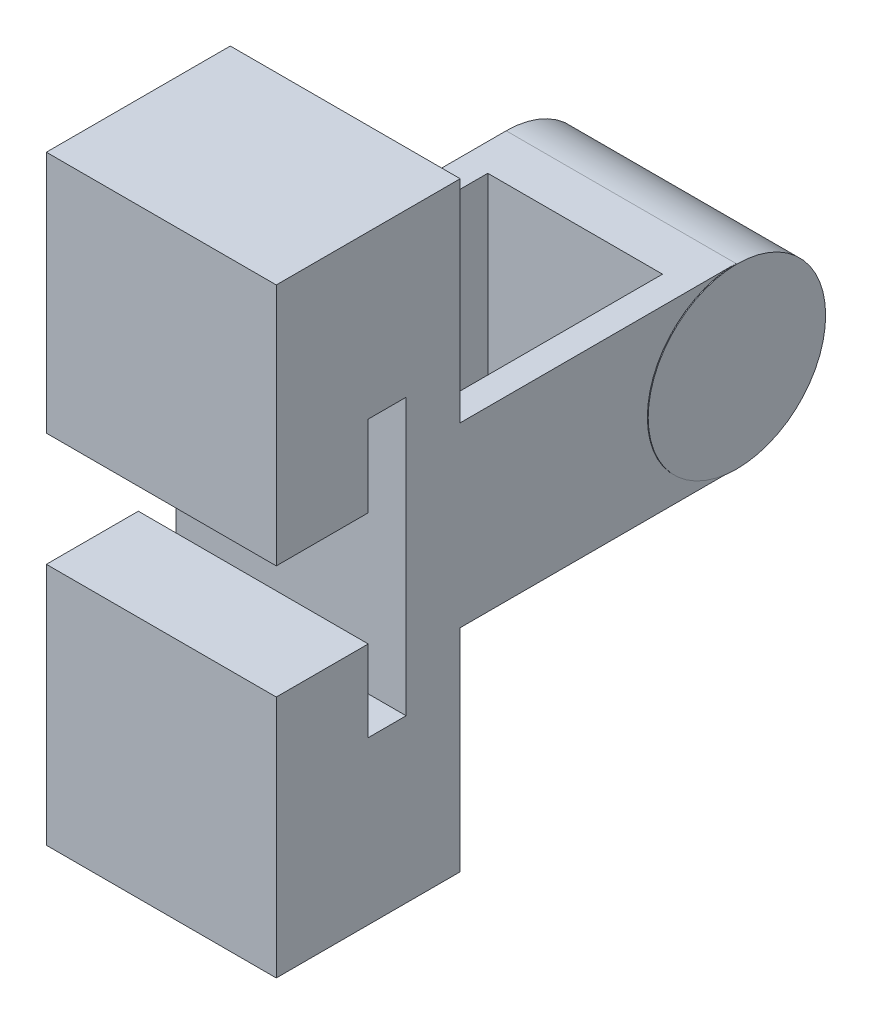
from build123d import *

# Parameters (mm, degrees)
SKETCH1_R           = 24.505905818
BOSS_EXTRUDE1_DEPTH = 0.2286
BOSS_EXTRUDE2_START = 63.5
BOSS_EXTRUDE2_DEPTH = 63.5
SKETCH4_W           = 63.5
SKETCH4_H           = 76.2
BOSS_EXTRUDE4_DEPTH = 14.929782549
SKETCH5_W           = 63.5
SKETCH5_H           = 50.8
BOSS_EXTRUDE5_DEPTH = 44.789347647
SKETCH7_W           = 63.5
SKETCH7_H           = 25.4
BOSS_EXTRUDE7_DEPTH = 22.41804
SKETCH8_W           = 63.5
SKETCH8_H           = 25.4
BOSS_EXTRUDE8_DEPTH = 22.41804
SKETCH9_W           = 48.26
SKETCH9_H           = 63.5
CUT_EXTRUDE1_DEPTH  = 179.030869421


with BuildPart() as part:
    # Sketch1 → Boss-Extrude1 (new body)
    with BuildSketch(Plane.YZ):
        Circle(SKETCH1_R)
    extrude(amount=BOSS_EXTRUDE1_DEPTH)

    # Sketch2 → Boss-Extrude2 (add)
    with BuildSketch(Plane(origin=(0, 0, 0), x_dir=(0, -1, 0), z_dir=(-1, 0, 0)).offset(BOSS_EXTRUDE2_START)):
        with BuildLine():
            Line((-24.505905818, 0), (-24.505905818, 76.2))
            Line((-24.505905818, 76.2), (24.505905818, 76.2))
            Line((24.505905818, 76.2), (24.505905818, 0))
            ThreePointArc((24.505905818, 0), (0, -24.505905818), (-24.505905818, 0))
        make_face()
    extrude(amount=-BOSS_EXTRUDE2_DEPTH)

    # Sketch4 → Boss-Extrude4 (add)
    with BuildSketch(Plane.XY.offset(76.2)):
        with Locations((-31.75, 0)):
            Rectangle(SKETCH4_W, SKETCH4_H)
    extrude(amount=BOSS_EXTRUDE4_DEPTH)

    # Sketch5 → Boss-Extrude5 (add)
    with BuildSketch(Plane(origin=(0, 38.1, 0), x_dir=(-1, 0, 0), z_dir=(0, 1, 0))):
        with Locations((31.75, 101.6)):
            Rectangle(SKETCH5_W, SKETCH5_H)
    boss_extrude5 = extrude(amount=BOSS_EXTRUDE5_DEPTH)

    # Mirror1: Boss-Extrude5 across plane
    add(boss_extrude5.mirror(Plane.ZX))

    # Sketch7 → Boss-Extrude7 (add)
    with BuildSketch(Plane.XZ.offset(-38.1)):
        with Locations((-31.75, 114.3)):
            Rectangle(SKETCH7_W, SKETCH7_H)
    extrude(amount=BOSS_EXTRUDE7_DEPTH)

    # Sketch8 → Boss-Extrude8 (add)
    with BuildSketch(Plane(origin=(0, -38.1, 0), x_dir=(-1, 0, 0), z_dir=(0, 1, 0))):
        with Locations((31.75, 114.3)):
            Rectangle(SKETCH8_W, SKETCH8_H)
    extrude(amount=BOSS_EXTRUDE8_DEPTH)

    # Sketch9 → Cut-Extrude1 (cut, through all)
    with BuildSketch(Plane.XZ.offset(24.505905818)):
        with Locations((-31.75, 44.45)):
            Rectangle(SKETCH9_W, SKETCH9_H)
    extrude(amount=-CUT_EXTRUDE1_DEPTH, mode=Mode.SUBTRACT)


solid = part.part
